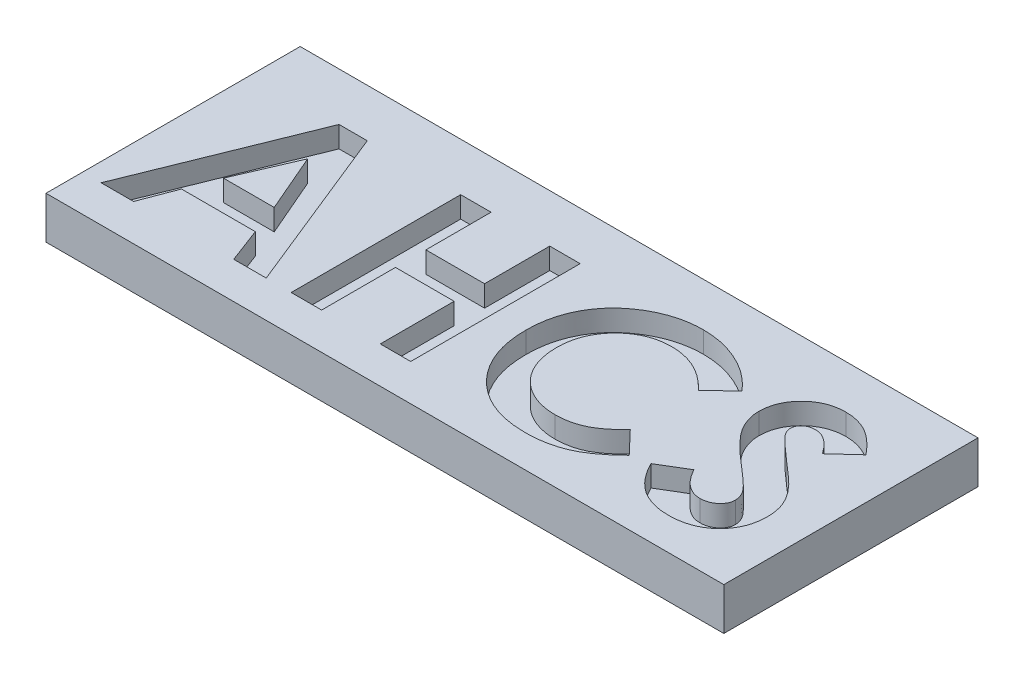
from build123d import *

# Parameters (mm, degrees)
SKETCH1_W           = 50.8
SKETCH1_H           = 19.05
BOSS_EXTRUDE1_DEPTH = 3.175
CUT_EXTRUDE1_DEPTH  = 1.5875


with BuildPart() as part:
    # Sketch1 → Boss-Extrude1 (new body)
    with BuildSketch(Plane(origin=(0, 0, 0), x_dir=(1, 0, 0), z_dir=(0, 1, 0))):
        Rectangle(SKETCH1_W, SKETCH1_H)
    extrude(amount=BOSS_EXTRUDE1_DEPTH)

    # Sketch2 → Cut-Extrude1 (cut)
    # profile 1 of 4: a face of its own
    with BuildSketch(Plane(origin=(0, 3.175, 0), x_dir=(1, 0, 0), z_dir=(0, 1, 0))):
        Polygon((-18.884635417, 5.922045616), (-16.770512821, 5.922045616), (-11.641666667, -6.777954384), (-14.076342147, -6.777954384), (-15.063441506, -4.172826179), (-20.596794872, -4.172826179), (-21.583894231, -6.777954384), (-24.016025641, -6.777954384), align=None)
        Polygon((-17.828846154, 2.515535199), (-19.731810897, -1.893339), (-15.92588141, -1.893339), align=None, mode=Mode.SUBTRACT)
    # profile 2 of 4: a face of its own
    with BuildSketch(Plane(origin=(0, 3.175, 0), x_dir=(1, 0, 0), z_dir=(0, 1, 0))):
        Polygon((-9.769230769, 5.922045616), (-7.48974359, 5.922045616), (-7.48974359, 1.037430231), (-3.093589744, 1.037430231), (-3.093589744, 5.922045616), (-0.814102564, 5.922045616), (-0.814102564, -6.777954384), (-3.093589744, -6.777954384), (-3.093589744, -1.242056948), (-7.48974359, -1.242056948), (-7.48974359, -6.777954384), (-9.769230769, -6.777954384), align=None)
    # profile 3 of 4: a face of its own
    with BuildSketch(Plane(origin=(0, 3.175, 0), x_dir=(1, 0, 0), z_dir=(0, 1, 0))):
        with BuildLine():
            Line((13.514102564, 3.718880552), (11.842648237, 2.121204269))
            add(Edge.make_bspline(
                [(11.842648237, 2.121204269), (11.700861864, 2.267811617), (11.423908657, 2.554181697), (10.977632817, 2.933310446), (10.513522191, 3.24926296), (10.040605127, 3.515356156), (9.550375217, 3.716674623), (9.048500854, 3.863378781), (8.531777423, 3.952818761), (8.182078879, 3.963052278), (8.006189904, 3.968199462)],
                knots=[0, 0, 0, 0, 1.115251505, 2.178435587, 3.19620269, 4.182487026, 5.141301733, 6.088180966, 7.038406374, 8, 8, 8, 8], degree=3))
            add(Edge.make_bspline(
                [(8.006189904, 3.968199462), (7.859301235, 3.964133007), (7.569432631, 3.956108305), (7.14382956, 3.897279328), (6.736718226, 3.797238093), (6.346705025, 3.659362739), (5.974937585, 3.480959349), (5.62063645, 3.262166002), (5.284675136, 3.004958714), (4.971491496, 2.710668287), (4.685002109, 2.38913388), (4.431870493, 2.046057435), (4.21983216, 1.68222492), (4.04581575, 1.301320965), (3.910263693, 0.901582556), (3.813462494, 0.483278814), (3.757475267, 0.045911572), (3.749118798, -0.251407421), (3.744871795, -0.402513679)],
                knots=[0, 0, 0, 0, 1.035432265, 2.043311493, 3.022114605, 3.98653278, 4.95457646, 5.923598177, 6.917315552, 7.932509744, 8.948865224, 9.949768934, 10.933144597, 11.912367597, 12.897413939, 13.903909035, 14.934704909, 16, 16, 16, 16], degree=3))
            add(Edge.make_bspline(
                [(3.744871795, -0.402513679), (3.746095733, -0.508570624), (3.74850814, -0.717611041), (3.774916198, -1.026839835), (3.817439398, -1.326864871), (3.878981005, -1.61723169), (3.95593939, -1.898191926), (4.046229098, -2.17216941), (4.159496208, -2.43537839), (4.28522441, -2.690875867), (4.43144486, -2.931690272), (4.589097479, -3.161326793), (4.760046005, -3.378659775), (4.945397682, -3.582800753), (5.147761103, -3.770559462), (5.361905923, -3.94758203), (5.59144447, -4.109436981), (5.831608644, -4.260186244), (6.084473163, -4.391143411), (6.343177224, -4.509765305), (6.611643303, -4.606103919), (6.886602664, -4.683761631), (7.167072699, -4.749797916), (7.455796666, -4.790458487), (7.75027169, -4.821250261), (7.949287378, -4.823151473), (8.049439103, -4.824108231)],
                knots=[0, 0, 0, 0, 1.103660481, 2.175337485, 3.227646561, 4.255952547, 5.262355991, 6.258840057, 7.255597736, 8.242457506, 9.22035537, 10.185017736, 11.140346927, 12.096287581, 13.051739095, 14.01125915, 14.986044842, 15.97314143, 16.960198552, 17.947847494, 18.933482797, 19.925264591, 20.920966487, 21.929612487, 22.958107872, 24, 24, 24, 24], degree=3))
            add(Edge.make_bspline(
                [(8.049439103, -4.824108231), (8.219313638, -4.819194557), (8.553072927, -4.809540468), (9.042912673, -4.734046852), (9.509681152, -4.609864128), (9.882626932, -4.463211545), (10.174820101, -4.318390217), (10.39726244, -4.184437619), (10.627285156, -4.034596932), (10.861067768, -3.863213004), (11.101239867, -3.672342513), (11.343561861, -3.457805038), (11.594237236, -3.22666499), (11.75845219, -3.061695798), (11.842648237, -2.977113038)],
                knots=[0, 0, 0, 0, 1.404581149, 2.759636711, 4.088442092, 5.392261763, 6.066678138, 6.783632037, 7.538459478, 8.336747902, 9.180226004, 10.074962426, 11.012997595, 12, 12, 12, 12], degree=3))
            Line((11.842648237, -2.977113038), (13.463221154, -4.679096211))
            add(Edge.make_bspline(
                [(13.463221154, -4.679096211), (13.349303601, -4.789080033), (13.126960899, -5.003744931), (12.791563106, -5.308549055), (12.456587424, -5.582449444), (12.130126168, -5.835387482), (11.806831563, -6.05999447), (11.486737892, -6.256494725), (11.173468757, -6.429858022), (10.860519023, -6.577160676), (10.545941356, -6.702235927), (10.222277904, -6.809917509), (9.888539198, -6.901012254), (9.542686914, -6.974513749), (9.187946952, -7.033452026), (8.820999417, -7.073235021), (8.444170937, -7.099979806), (8.188562341, -7.102383046), (8.059615385, -7.10359541)],
                knots=[0, 0, 0, 0, 1.244526981, 2.429050516, 3.560637417, 4.644440555, 5.67424972, 6.652764056, 7.595344123, 8.486817594, 9.369275933, 10.254498637, 11.166417451, 12.086725134, 13.032340136, 13.991389299, 14.986715468, 16, 16, 16, 16], degree=3))
            add(Edge.make_bspline(
                [(8.059615385, -7.10359541), (7.822755798, -7.097557387), (7.359287427, -7.085742654), (6.680086613, -6.998203481), (6.034864072, -6.8514456), (5.422050098, -6.643889477), (4.841839552, -6.378746258), (4.294380868, -6.05369312), (3.78055643, -5.669593681), (3.304516927, -5.230949957), (2.873916541, -4.746504787), (2.493315665, -4.226343579), (2.178482606, -3.667909928), (1.917069934, -3.079453685), (1.712648662, -2.458289495), (1.568770742, -1.803745448), (1.480042279, -1.116453546), (1.470335259, -0.647017334), (1.465384615, -0.40760182)],
                knots=[0, 0, 0, 0, 1.078019885, 2.10938526, 3.111377082, 4.085535484, 5.04941344, 6.010039228, 6.978205633, 7.964457913, 8.951525778, 9.924444315, 10.892603023, 11.863865945, 12.85144698, 13.863884204, 14.910567087, 16, 16, 16, 16], degree=3))
            add(Edge.make_bspline(
                [(1.465384615, -0.40760182), (1.467476517, -0.251457065), (1.471622155, 0.057983677), (1.515193197, 0.51381496), (1.575933763, 0.958168925), (1.672293147, 1.386431706), (1.78844488, 1.804372792), (1.932894822, 2.207449651), (2.105412264, 2.596820768), (2.300436565, 2.973137972), (2.521065605, 3.333935983), (2.767532463, 3.676114977), (3.033492121, 4.002316514), (3.325335157, 4.308212923), (3.638820708, 4.596490036), (3.975364127, 4.865585622), (4.332941272, 5.119358818), (4.712519973, 5.351265427), (5.106726025, 5.561037281), (5.510587454, 5.746065016), (5.923112019, 5.900705593), (6.342555529, 6.028974248), (6.770690127, 6.124717728), (7.204459897, 6.197192455), (7.647555699, 6.23770629), (7.945056143, 6.244338664), (8.095232372, 6.247686641)],
                knots=[0, 0, 0, 0, 1.071919942, 2.124283339, 3.142214191, 4.149696895, 5.136002878, 6.119640489, 7.086990633, 8.058538607, 9.028339693, 9.988281803, 10.952401235, 11.916291999, 12.888973767, 13.874849856, 14.873389453, 15.898127285, 16.927174885, 17.938320013, 18.946391617, 19.950418109, 20.947802303, 21.956882652, 22.968648068, 24, 24, 24, 24], degree=3))
            add(Edge.make_bspline(
                [(8.095232372, 6.247686641), (8.223348093, 6.245767497), (8.478247489, 6.241949162), (8.857835463, 6.210119187), (9.23438767, 6.160130532), (9.606555938, 6.084708298), (9.977002394, 5.995172575), (10.340858957, 5.877937896), (10.703865661, 5.747257754), (11.060329286, 5.591056326), (11.410747401, 5.420548359), (11.746910911, 5.227100878), (12.07446397, 5.022618425), (12.386148199, 4.794998833), (12.687802114, 4.552498288), (12.977848341, 4.293985388), (13.253741555, 4.015149964), (13.426876817, 3.818136277), (13.514102564, 3.718880552)],
                knots=[0, 0, 0, 0, 0.996412454, 1.982464992, 2.961075852, 3.949442424, 4.934965278, 5.923860011, 6.921385422, 7.934793307, 8.949617135, 9.951082467, 10.950285876, 11.951772932, 12.951063433, 13.960125323, 14.972308753, 16, 16, 16, 16], degree=3))
        make_face()
    # profile 4 of 4: a face of its own
    with BuildSketch(Plane(origin=(0, 3.175, 0), x_dir=(1, 0, 0), z_dir=(0, 1, 0))):
        with BuildLine():
            Line((22.306410256, 4.225150584), (20.601883013, 2.665635359))
            add(Edge.make_bspline(
                [(20.601883013, 2.665635359), (20.528868375, 2.768630097), (20.388690451, 2.966365631), (20.161476659, 3.231138171), (19.935288853, 3.457008852), (19.708031541, 3.643034091), (19.477690402, 3.788083645), (19.244665273, 3.890780331), (19.010277239, 3.956065589), (18.852804661, 3.964195175), (18.775240385, 3.968199462)],
                knots=[0, 0, 0, 0, 1.299362458, 2.494594718, 3.587462134, 4.587049575, 5.512617175, 6.380583204, 7.202344345, 8, 8, 8, 8], degree=3))
            add(Edge.make_bspline(
                [(18.775240385, 3.968199462), (18.702890652, 3.965662162), (18.563202328, 3.960763302), (18.364066258, 3.912069002), (18.18727042, 3.828029792), (18.032987357, 3.718141454), (17.910772409, 3.585751484), (17.81319325, 3.446908445), (17.758247984, 3.29365713), (17.751016106, 3.188397945), (17.747435897, 3.136288404)],
                knots=[0, 0, 0, 0, 1.185010067, 2.2879431, 3.333075148, 4.379039566, 5.372662701, 6.27520591, 7.14612461, 8, 8, 8, 8], degree=3))
            add(Edge.make_bspline(
                [(17.747435897, 3.136288404), (17.749679433, 3.083427421), (17.754197601, 2.976972746), (17.797836956, 2.820950163), (17.863613924, 2.668497937), (17.926466503, 2.575693012), (17.95859375, 2.528255552)],
                knots=[0, 0, 0, 0, 0.967525499, 1.948461899, 2.951351359, 4, 4, 4, 4], degree=3))
            add(Edge.make_bspline(
                [(17.95859375, 2.528255552), (17.987800893, 2.49138291), (18.055031879, 2.406506958), (18.183227599, 2.272076681), (18.3442145, 2.107387825), (18.544187697, 1.918103556), (18.774845752, 1.697416473), (19.046879965, 1.454001869), (19.352460004, 1.180321476), (19.569659216, 0.989740361), (19.683473558, 0.889874141)],
                knots=[0, 0, 0, 0, 0.473873513, 1.090794244, 1.870441696, 2.795289791, 3.865433203, 5.087734844, 6.473946851, 8, 8, 8, 8], degree=3))
            add(Edge.make_bspline(
                [(19.683473558, 0.889874141), (19.790304689, 0.797417185), (19.993047982, 0.621953092), (20.281511427, 0.372909983), (20.535022752, 0.148851971), (20.757275039, -0.046858314), (20.944899159, -0.21627432), (21.098683885, -0.360205854), (21.220507437, -0.475850833), (21.289756994, -0.545700471), (21.319310897, -0.575510474)],
                knots=[0, 0, 0, 0, 1.543621617, 2.929473131, 4.163658386, 5.240097082, 6.164993805, 6.925417477, 7.541396219, 8, 8, 8, 8], degree=3))
            add(Edge.make_bspline(
                [(21.319310897, -0.575510474), (21.431432247, -0.696849787), (21.646968856, -0.930106559), (21.927090465, -1.291581198), (22.157639611, -1.644454151), (22.335996802, -1.995365296), (22.470699327, -2.349377583), (22.565666391, -2.715173143), (22.622542797, -3.096574311), (22.628857406, -3.356834048), (22.632051282, -3.488471211)],
                knots=[0, 0, 0, 0, 1.206664779, 2.319633467, 3.337109185, 4.282041471, 5.190008762, 6.099243693, 7.03861361, 8, 8, 8, 8], degree=3))
            add(Edge.make_bspline(
                [(22.632051282, -3.488471211), (22.629777963, -3.616735483), (22.625317627, -3.868394759), (22.570687061, -4.236660623), (22.492787081, -4.589107037), (22.372340046, -4.921898887), (22.225539913, -5.240498849), (22.041504745, -5.53994415), (21.825380674, -5.823265297), (21.577669304, -6.085397579), (21.303671115, -6.323264456), (21.009782017, -6.535019168), (20.693128215, -6.709849655), (20.356415148, -6.853810091), (19.999823051, -6.964690344), (19.623776734, -7.046641185), (19.227701007, -7.095826787), (18.956858718, -7.100968559), (18.818489583, -7.10359541)],
                knots=[0, 0, 0, 0, 1.043214005, 2.046824704, 3.02475056, 3.976699089, 4.921714032, 5.875962561, 6.831408892, 7.817874052, 8.806269674, 9.781291748, 10.760897367, 11.74438705, 12.757449933, 13.795994037, 14.874007457, 16, 16, 16, 16], degree=3))
            add(Edge.make_bspline(
                [(18.818489583, -7.10359541), (18.709870991, -7.101668444), (18.494743885, -7.097851946), (18.177679054, -7.066693415), (17.871517118, -7.016406861), (17.57660294, -6.944331208), (17.29160788, -6.853001579), (17.016520235, -6.741445937), (16.753239024, -6.60793521), (16.499772137, -6.45521491), (16.257351738, -6.277886524), (16.022912514, -6.079575474), (15.798783139, -5.857231647), (15.583887165, -5.611380877), (15.379599556, -5.341326974), (15.179233245, -5.050830939), (14.991693116, -4.734501559), (14.875841235, -4.512593941), (14.816666667, -4.399248455)],
                knots=[0, 0, 0, 0, 1.016823716, 2.013894106, 2.979844003, 3.91962641, 4.853723003, 5.779685073, 6.695824784, 7.614987388, 8.547259901, 9.504950863, 10.487499108, 11.500346958, 12.559593716, 13.656357062, 14.802919212, 16, 16, 16, 16], degree=3))
            Line((14.816666667, -4.399248455), (16.821394231, -3.195903102))
            add(Edge.make_bspline(
                [(16.821394231, -3.195903102), (16.895412772, -3.324565038), (17.037312642, -3.571220965), (17.277775238, -3.902634465), (17.524116891, -4.186435268), (17.7820328, -4.417607178), (18.048386804, -4.59924126), (18.324465455, -4.729049576), (18.61046272, -4.809400776), (18.805271064, -4.819213514), (18.90244391, -4.824108231)],
                knots=[0, 0, 0, 0, 1.283663364, 2.460892379, 3.537111102, 4.529833553, 5.449777664, 6.316464042, 7.160231139, 8, 8, 8, 8], degree=3))
            add(Edge.make_bspline(
                [(18.90244391, -4.824108231), (19.001282607, -4.82011094), (19.193044074, -4.812355613), (19.466759029, -4.740721999), (19.717711264, -4.62825197), (19.934632523, -4.467772748), (20.118307768, -4.282555335), (20.253870641, -4.076492494), (20.339032153, -3.853537474), (20.348035789, -3.698658252), (20.352564103, -3.620762878)],
                knots=[0, 0, 0, 0, 1.13588714, 2.203786484, 3.234766741, 4.283437687, 5.291419208, 6.222934724, 7.106237994, 8, 8, 8, 8], degree=3))
            add(Edge.make_bspline(
                [(20.352564103, -3.620762878), (20.348382391, -3.548293908), (20.339887643, -3.401080134), (20.277317951, -3.182196924), (20.179502439, -2.963413258), (20.063779789, -2.783960975), (19.946017503, -2.633710444), (19.833410196, -2.503525155), (19.696284284, -2.359693202), (19.534987459, -2.202033656), (19.351650871, -2.029158598), (19.146120085, -1.841084959), (18.916041554, -1.639469441), (18.753421594, -1.502130943), (18.668389423, -1.430318166)],
                knots=[0, 0, 0, 0, 0.916159276, 1.861089862, 2.860218735, 3.940849679, 4.552606315, 5.27541173, 6.11797699, 7.06649574, 8.129236253, 9.306560635, 10.591630461, 12, 12, 12, 12], degree=3))
            add(Edge.make_bspline(
                [(18.668389423, -1.430318166), (18.506739881, -1.293547153), (18.196485482, -1.03104218), (17.758056654, -0.6433306), (17.362993023, -0.280978602), (17.014706784, 0.060493276), (16.708760231, 0.374778839), (16.447225366, 0.664430836), (16.23297527, 0.931683535), (16.007523242, 1.248226473), (15.793298739, 1.633955792), (15.608147977, 2.09803288), (15.488029977, 2.562051084), (15.474572426, 2.873567348), (15.467948718, 3.026893372)],
                knots=[0, 0, 0, 0, 1.345494975, 2.582412109, 3.71882943, 4.751509156, 5.681369928, 6.505683931, 7.230279997, 7.856715994, 8.973648664, 10.023341002, 11.027102913, 12, 12, 12, 12], degree=3))
            add(Edge.make_bspline(
                [(15.467948718, 3.026893372), (15.470703509, 3.135623959), (15.476130744, 3.349834895), (15.524542518, 3.664800865), (15.596895758, 3.968716561), (15.701973434, 4.260473161), (15.83835157, 4.539705228), (16.003977519, 4.80777972), (16.201423138, 5.06222934), (16.423931021, 5.302885407), (16.669077739, 5.522817665), (16.931048162, 5.71692992), (17.208359512, 5.880879953), (17.499315341, 6.01688841), (17.805718579, 6.120994244), (18.125311969, 6.194789648), (18.458553908, 6.238680802), (18.685217882, 6.244647295), (18.80068109, 6.247686641)],
                knots=[0, 0, 0, 0, 1.010766082, 1.991317756, 2.957454644, 3.913069143, 4.869106762, 5.843196583, 6.838735724, 7.860187025, 8.887984031, 9.89767229, 10.887916223, 11.879572884, 12.879850636, 13.892031539, 14.926195476, 16, 16, 16, 16], degree=3))
            add(Edge.make_bspline(
                [(18.80068109, 6.247686641), (18.950315692, 6.242212689), (19.248403734, 6.231307993), (19.689135502, 6.146036836), (20.119623866, 6.01193896), (20.466519457, 5.850164626), (20.742537804, 5.693453752), (20.954080083, 5.54917412), (21.169335739, 5.383894046), (21.390040675, 5.197092691), (21.61209385, 4.98525047), (21.8418093, 4.753410455), (22.07605687, 4.499569007), (22.22828065, 4.318225853), (22.306410256, 4.225150584)],
                knots=[0, 0, 0, 0, 1.282922637, 2.555718331, 3.837320111, 5.142675274, 5.830281639, 6.55870424, 7.337177975, 8.157850921, 9.037902056, 9.96903443, 10.957596896, 12, 12, 12, 12], degree=3))
        make_face()
    extrude(amount=-CUT_EXTRUDE1_DEPTH, mode=Mode.SUBTRACT)


solid = part.part
